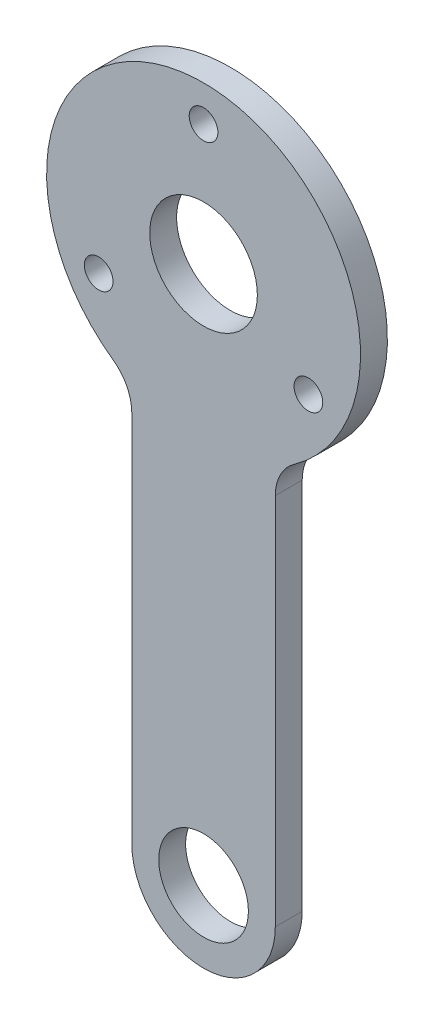
from build123d import *

# Parameters (mm, degrees)
SKETCH_1_R      = 1.6
SKETCH_1_R_2    = 6
SKETCH_1_R_3    = 5
EXTRUDE_1_DEPTH = 3


with BuildPart() as part:
    # 草图1 → 凸台-拉伸1 (new body)
    with BuildSketch(Plane.XY):
        with BuildLine():
            Line((-8, -60), (-8, -18.364367672))
            ThreePointArc((-8, -18.364367672), (-8.559029135, -16.067026214), (-10.111111111, -14.283397078))
            ThreePointArc((-10.111111111, -14.283397078), (0, 17.5), (10.111111111, -14.283397078))
            ThreePointArc((10.111111111, -14.283397078), (8.559029135, -16.067026214), (8, -18.364367672))
            Line((8, -18.364367672), (8, -60))
            ThreePointArc((8, -60), (0, -68), (-8, -60))
        make_face()
        with Locations((0, 13.5)):
            Circle(SKETCH_1_R, mode=Mode.SUBTRACT)
        with Locations((11.691342951, -6.75)):
            Circle(SKETCH_1_R, mode=Mode.SUBTRACT)
        with Locations((-11.691342951, -6.75)):
            Circle(SKETCH_1_R, mode=Mode.SUBTRACT)
        Circle(SKETCH_1_R_2, mode=Mode.SUBTRACT)
        with Locations((0, -60)):
            Circle(SKETCH_1_R_3, mode=Mode.SUBTRACT)
    extrude(amount=EXTRUDE_1_DEPTH)


solid = part.part
